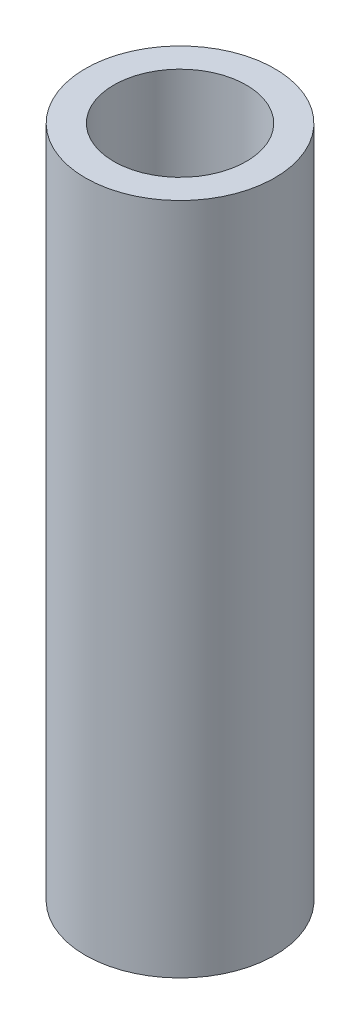
from build123d import *

# Parameters (mm, degrees)
SKETCH1_R           = 2.8575
SKETCH1_R_2         = 2
BOSS_EXTRUDE1_DEPTH = 20.32


with BuildPart() as part:
    # Sketch1 → Boss-Extrude1 (new body)
    with BuildSketch(Plane(origin=(0, 0, 0), x_dir=(1, 0, 0), z_dir=(0, 1, 0))):
        with Locations(Location((0, 0, 0), (0, 0, 270))):
            Circle(SKETCH1_R)
        with Locations(Location((0, 0, 0), (0, 0, 270))):
            Circle(SKETCH1_R_2, mode=Mode.SUBTRACT)
    extrude(amount=-BOSS_EXTRUDE1_DEPTH)


solid = part.part
